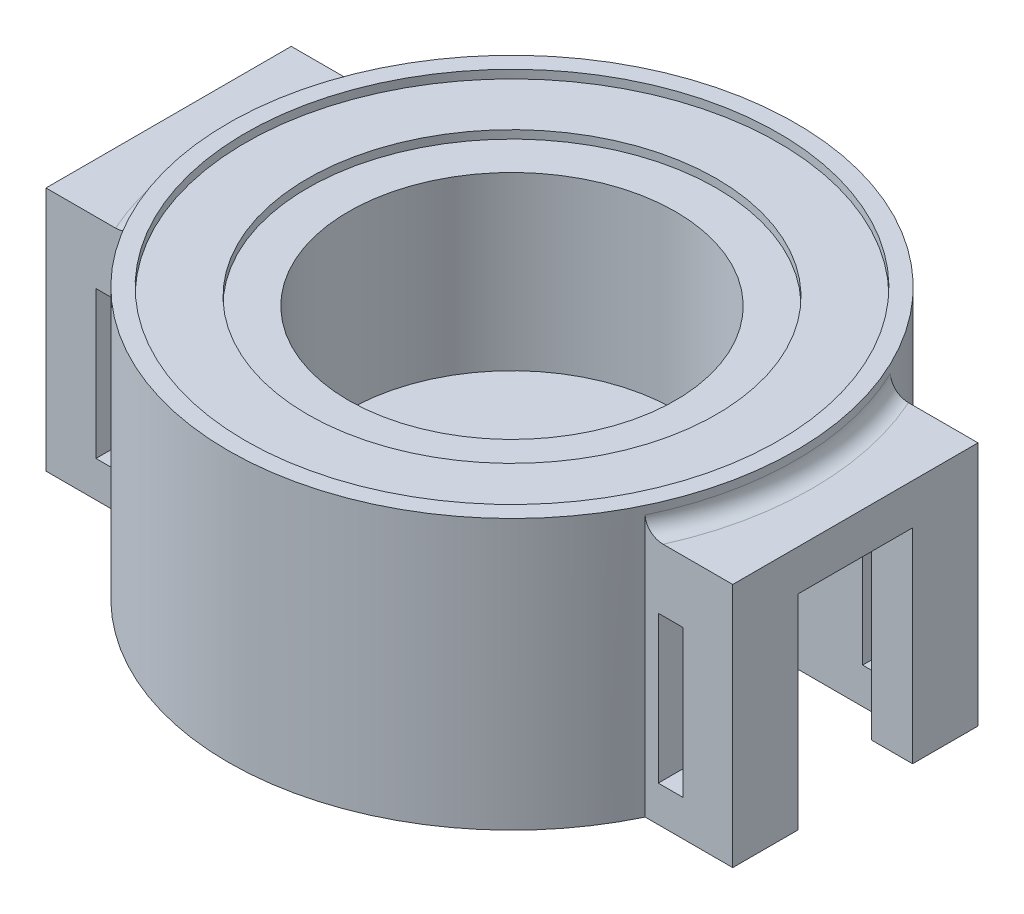
from build123d import *

# Parameters (mm, degrees)
SKETCH1_R           = 44.069
BOSS_EXTRUDE1_DEPTH = 40.64
SKETCH2_R           = 44.069
SKETCH2_R_2         = 41.402
BOSS_EXTRUDE2_DEPTH = 1.2954
BOSS_EXTRUDE3_DEPTH = 38.1
CUT_EXTRUDE1_DEPTH  = 31.75
SKETCH5_W           = 3.81
SKETCH5_H           = 22.86
CUT_EXTRUDE2_DEPTH  = 93.670068167
FILLET1_R           = 2.54
SKETCH7_R           = 25.4
CUT_EXTRUDE3_DEPTH  = 27.94
SKETCH8_R           = 11.43
CUT_EXTRUDE4_DEPTH  = 81.906181129
SKETCH9_R           = 31.75
CUT_EXTRUDE5_DEPTH  = 1.27


with BuildPart() as part:
    # Sketch1 → Boss-Extrude1 (new body)
    with BuildSketch(Plane(origin=(0, 0, 0), x_dir=(1, 0, 0), z_dir=(0, 1, 0))):
        with Locations(Location((0, 0, 0), (0, 0, 270))):
            Circle(SKETCH1_R)
    extrude(amount=BOSS_EXTRUDE1_DEPTH)

    # Sketch2 → Boss-Extrude2 (add)
    with BuildSketch(Plane(origin=(0, 40.64, 0), x_dir=(1, 0, 0), z_dir=(0, 1, 0))):
        with Locations(Location((0, 0, 0), (0, 0, 270))):
            Circle(SKETCH2_R)
        with Locations(Location((0, 0, 0), (0, 0, 270))):
            Circle(SKETCH2_R_2, mode=Mode.SUBTRACT)
    extrude(amount=BOSS_EXTRUDE2_DEPTH)

    # Sketch3 → Boss-Extrude3 (add)
    with BuildSketch(Plane(origin=(0, 0, 0), x_dir=(1, 0, 0), z_dir=(0, 1, 0))):
        with BuildLine():
            ThreePointArc((39.738825612, -19.05), (44.069, 0), (39.738825612, 19.05))
            Line((39.738825612, 19.05), (53.34, 19.05))
            Line((53.34, 19.05), (53.34, -19.05))
            Line((53.34, -19.05), (39.738825612, -19.05))
        make_face()
        with BuildLine():
            ThreePointArc((-39.738825612, 19.05), (-44.069, 0), (-39.738825612, -19.05))
            Line((-39.738825612, -19.05), (-53.34, -19.05))
            Line((-53.34, -19.05), (-53.34, 19.05))
            Line((-53.34, 19.05), (-39.738825612, 19.05))
        make_face()
    extrude(amount=BOSS_EXTRUDE3_DEPTH)

    # Sketch4 → Cut-Extrude1 (cut)
    with BuildSketch(Plane(origin=(0, 0, 0), x_dir=(1, 0, 0), z_dir=(0, 1, 0))):
        Polygon((-53.34, -8.89), (-53.34, 8.89), (-46.99, 8.89), (-46.99, 12.7), (-31.75, 12.7), (-31.75, -12.7), (-46.99, -12.7), (-46.99, -8.89), align=None)
        Polygon((46.99, -12.7), (46.99, -8.89), (53.34, -8.89), (53.34, 8.89), (46.99, 8.89), (46.99, 12.7), (31.75, 12.7), (31.75, -12.7), align=None)
    extrude(amount=CUT_EXTRUDE1_DEPTH, mode=Mode.SUBTRACT)

    # Sketch5 → Cut-Extrude2 (cut, through all)
    with BuildSketch(Plane(origin=(0, 0, -19.05), x_dir=(-1, 0, 0), z_dir=(0, 0, -1))):
        with Locations((43.675825612, 17.018)):
            Rectangle(SKETCH5_W, SKETCH5_H)
        with Locations((-43.675825612, 17.018)):
            Rectangle(SKETCH5_W, SKETCH5_H)
    extrude(amount=-CUT_EXTRUDE2_DEPTH, mode=Mode.SUBTRACT)

    # Fillet1
    fillet1_edges = [part.edges().sort_by_distance(p)[0] for p in [
        (44.069, 38.1, 0),
        (-44.069, 38.1, 0),
    ]]
    fillet(fillet1_edges, radius=FILLET1_R)

    # Sketch7 → Cut-Extrude3 (cut)
    with BuildSketch(Plane(origin=(0, 40.64, 0), x_dir=(1, 0, 0), z_dir=(0, 1, 0))):
        with Locations(Location((0, 0, 0), (0, 0, 270))):
            Circle(SKETCH7_R)
    extrude(amount=-CUT_EXTRUDE3_DEPTH, mode=Mode.SUBTRACT)

    # Sketch8 → Cut-Extrude4 (cut, through all)
    with BuildSketch(Plane.XZ):
        with Locations(Location((0, 0, 0), (0, 0, 270))):
            Circle(SKETCH8_R)
    extrude(amount=-CUT_EXTRUDE4_DEPTH, mode=Mode.SUBTRACT)

    # Sketch9 → Cut-Extrude5 (cut)
    with BuildSketch(Plane(origin=(0, 40.64, 0), x_dir=(1, 0, 0), z_dir=(0, 1, 0))):
        with Locations(Location((0, 0, 0), (0, 0, 270))):
            Circle(SKETCH9_R)
    extrude(amount=-CUT_EXTRUDE5_DEPTH, mode=Mode.SUBTRACT)


solid = part.part
